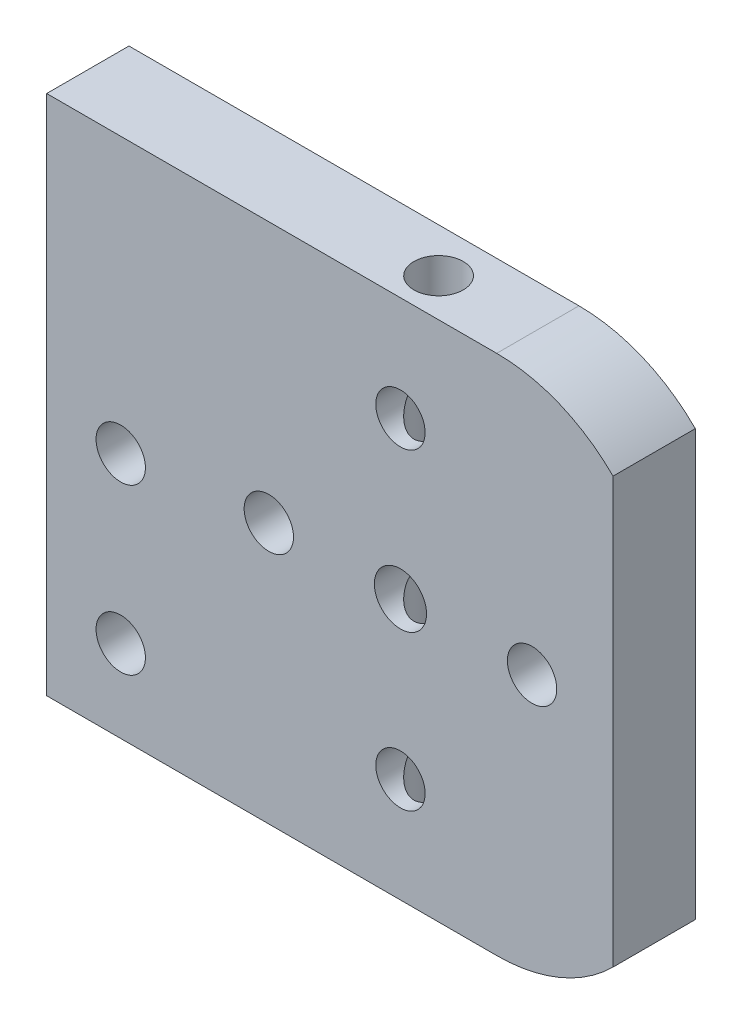
from build123d import *

# Parameters (mm, degrees)
CROQUIS1_R              = 1.585
CROQUIS1_R_2            = 1.5
SALIENTE_EXTRUIR1_DEPTH = 5
CROQUIS2_R              = 1.5
CORTAR_EXTRUIR1_DEPTH   = 35


with BuildPart() as part:
    # Croquis1 → Saliente-Extruir1 (new body)
    with BuildSketch(Plane.XY):
        with BuildLine():
            Line((-13.632801604, 23.936623068), (-13.632801604, 2.936623068))
            Line((-13.632801604, 2.936623068), (-13.632801604, -7.763376932))
            Line((-13.632801604, -7.763376932), (13.717198396, -7.763376932))
            ThreePointArc((13.717198396, -7.763376932), (17.54403272, -7.002172257), (20.788266208, -4.834444744))
            Line((20.788266208, -4.834444744), (20.788266208, 21.00769088))
            ThreePointArc((20.788266208, 21.00769088), (17.54403272, 23.175418393), (13.717198396, 23.936623068))
            Line((13.717198396, 23.936623068), (-13.632801604, 23.936623068))
        make_face()
        with Locations((7.867198396, 8.086623068)):
            Circle(CROQUIS1_R, mode=Mode.SUBTRACT)
        with Locations((-0.132801604, 8.086623068)):
            Circle(CROQUIS1_R_2, mode=Mode.SUBTRACT)
        with Locations((7.867198396, -1.413376932)):
            Circle(CROQUIS1_R_2, mode=Mode.SUBTRACT)
        with Locations((15.867198396, 8.086623068)):
            Circle(CROQUIS1_R_2, mode=Mode.SUBTRACT)
        with Locations((7.867198396, 17.586623068)):
            Circle(CROQUIS1_R_2, mode=Mode.SUBTRACT)
        with Locations((-9.132801604, 7.236623068)):
            Circle(CROQUIS1_R_2, mode=Mode.SUBTRACT)
        with Locations((-9.132801604, -2.763376932)):
            Circle(CROQUIS1_R_2, mode=Mode.SUBTRACT)
    extrude(amount=SALIENTE_EXTRUIR1_DEPTH)

    # Croquis2 → Cortar-Extruir1 (cut)
    with BuildSketch(Plane(origin=(0, 23.936623068, 0), x_dir=(1, 0, 0), z_dir=(0, 1, 0))):
        with Locations(Location((7.867198396, -2.682084827, 0), (0, 0, 270))):
            Circle(CROQUIS2_R)
    extrude(amount=-CORTAR_EXTRUIR1_DEPTH, mode=Mode.SUBTRACT)


solid = part.part
